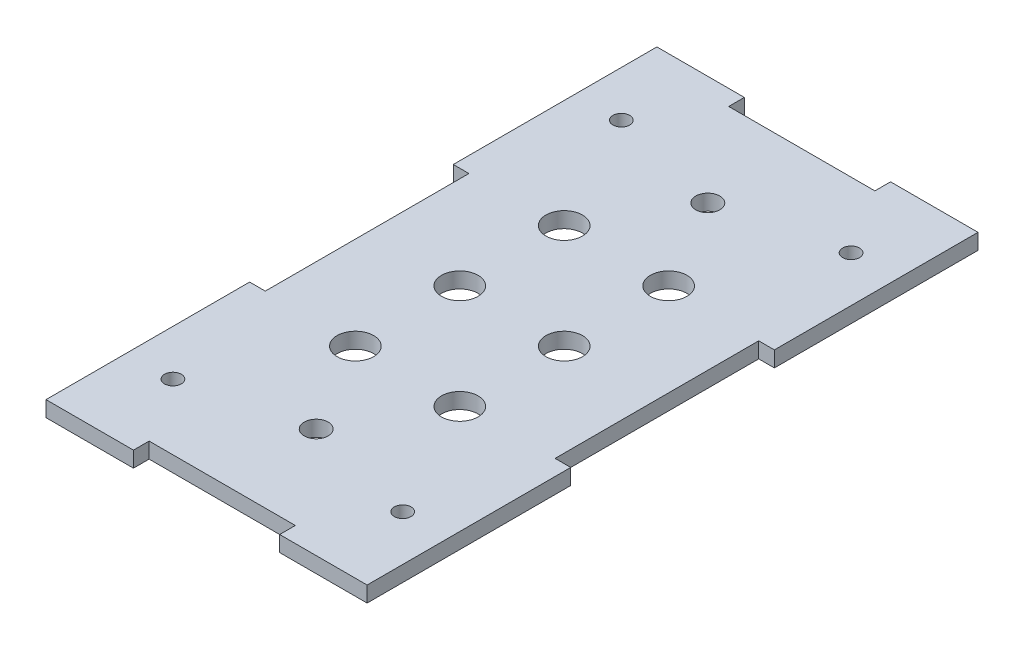
from build123d import *

# Parameters (mm, degrees)
SKETCH1_R           = 1.609204822
SKETCH1_R_2         = 2.3
SKETCH1_R_3         = 3.5
BOSS_EXTRUDE1_DEPTH = 3


with BuildPart() as part:
    # Sketch1 → Boss-Extrude1 (new body)
    with BuildSketch(Plane(origin=(0, 0, 0), x_dir=(1, 0, 0), z_dir=(0, 1, 0))):
        Polygon((-30.75, 58.5), (-30.75, 19.5), (-27.75, 19.5), (-27.75, -19.5), (-30.75, -19.5), (-30.75, -58.5), (-14, -58.5), (-14, -55.5), (14, -55.5), (14, -58.5), (30.75, -58.5), (30.75, -19.5), (27.75, -19.5), (27.75, 19.5), (30.75, 19.5), (30.75, 58.5), (14, 58.5), (14, 55.5), (-14, 55.5), (-14, 58.5), align=None)
        with Locations(Location((-22, -42.94, 0), (0, 0, 270))):
            Circle(SKETCH1_R, mode=Mode.SUBTRACT)
        with Locations(Location((22, -42.94, 0), (0, 0, 270))):
            Circle(SKETCH1_R, mode=Mode.SUBTRACT)
        with Locations(Location((22, 42.94, 0), (0, 0, 270))):
            Circle(SKETCH1_R, mode=Mode.SUBTRACT)
        with Locations(Location((-22, 42.94, 0), (0, 0, 270))):
            Circle(SKETCH1_R, mode=Mode.SUBTRACT)
        with Locations(Location((0, 37.5, 0), (0, 0, 270))):
            Circle(SKETCH1_R_2, mode=Mode.SUBTRACT)
        with Locations(Location((0, -37.5, 0), (0, 0, 270))):
            Circle(SKETCH1_R_2, mode=Mode.SUBTRACT)
        with Locations(Location((-10, -20, 0), (0, 0, 270))):
            Circle(SKETCH1_R_3, mode=Mode.SUBTRACT)
        with Locations(Location((10, -20, 0), (0, 0, 270))):
            Circle(SKETCH1_R_3, mode=Mode.SUBTRACT)
        with Locations(Location((-10, 0, 0), (0, 0, 270))):
            Circle(SKETCH1_R_3, mode=Mode.SUBTRACT)
        with Locations(Location((10, 0, 0), (0, 0, 270))):
            Circle(SKETCH1_R_3, mode=Mode.SUBTRACT)
        with Locations(Location((-10, 20, 0), (0, 0, 270))):
            Circle(SKETCH1_R_3, mode=Mode.SUBTRACT)
        with Locations(Location((10, 20, 0), (0, 0, 270))):
            Circle(SKETCH1_R_3, mode=Mode.SUBTRACT)
    extrude(amount=BOSS_EXTRUDE1_DEPTH)


solid = part.part
